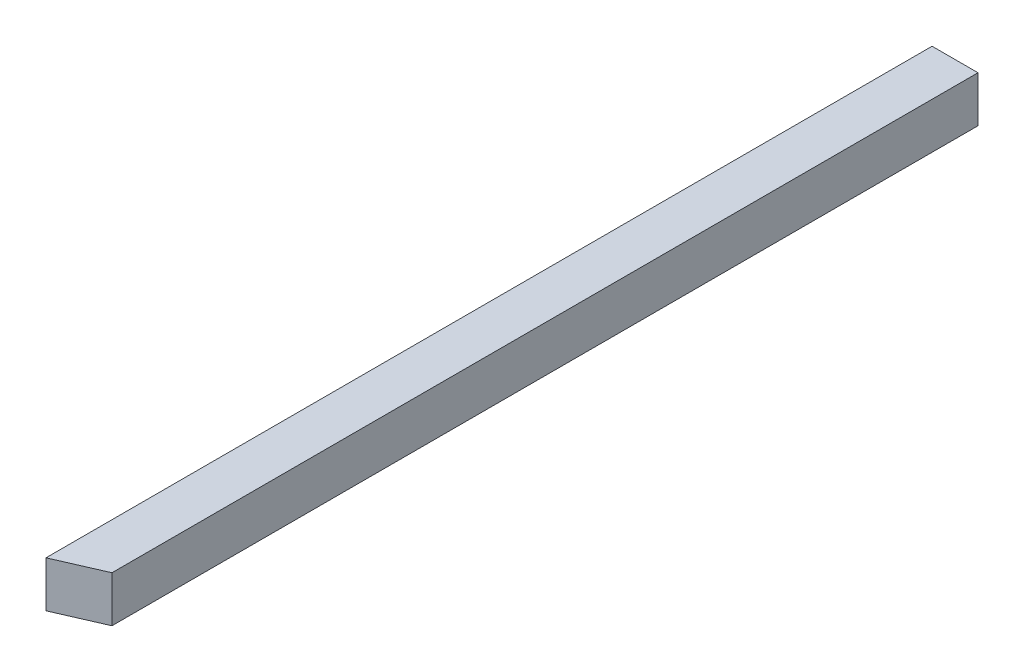
from build123d import *

# Parameters (mm, degrees)
SKETCH1_W               = 10
SKETCH1_H               = 10
BOSS_EXTRUDE1_DEPTH     = 300
CUT_EXTRUDE1_DEPTH      = 301.333148354
CUT_EXTRUDE1_DEPTH_BACK = 301.333148354


with BuildPart() as part:
    # Sketch1 → Boss-Extrude1 (new body)
    with BuildSketch(Plane.XY):
        with Locations((5, -5)):
            Rectangle(SKETCH1_W, SKETCH1_H)
    extrude(amount=BOSS_EXTRUDE1_DEPTH)

    # Sketch2 → Cut-Extrude1 (cut, two sides: drawn at the far end of the back side and taken through both)
    with BuildSketch(Plane.XZ.offset(10).offset(-CUT_EXTRUDE1_DEPTH_BACK)):
        Polygon((0, 192.908466216), (10, 188.546655864), (10, 300), (0, 300), align=None)
    extrude(amount=CUT_EXTRUDE1_DEPTH + CUT_EXTRUDE1_DEPTH_BACK, mode=Mode.SUBTRACT)


solid = part.part
